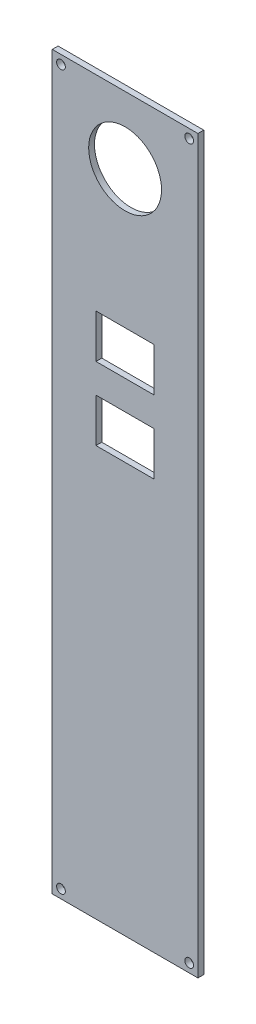
from build123d import *

# Parameters (mm, degrees)
SKETCH1_W           = 50
SKETCH1_H           = 251
BOSS_EXTRUDE1_DEPTH = 2
CUT_EXTRUDE1_REACH  = 130.472
SKETCH2_R           = 12.5
SKETCH6_R           = 1.5
CUT_EXTRUDE5_DEPTH  = 2
SKETCH8_W           = 20
SKETCH8_H           = 15
CUT_EXTRUDE6_DEPTH  = 2


with BuildPart() as part:
    # Sketch1 → Boss-Extrude1 (new body)
    with BuildSketch(Plane(origin=(0, 15.253788563, 0), x_dir=(1, 0, 0), z_dir=(0, 0, 1))):
        with Locations((0, -0.5)):
            Rectangle(SKETCH1_W, SKETCH1_H)
    extrude(amount=BOSS_EXTRUDE1_DEPTH)

    # Sketch2 → Cut-Extrude1 (cut, up to next)
    with BuildSketch(Plane(origin=(0, 15.253788563, 0), x_dir=(-1, 0, 0), z_dir=(0, 0, -1)), mode=Mode.PRIVATE) as cut_extrude1_sk1:
        with Locations((0, 102)):
            Circle(SKETCH2_R)
    cut_extrude1_tool1 = extrude(cut_extrude1_sk1.sketch, amount=-CUT_EXTRUDE1_REACH, mode=Mode.PRIVATE) & part.part
    add(cut_extrude1_tool1.solids().sort_by_distance((0, 117.253789, 0))[0], mode=Mode.SUBTRACT)

    # Sketch6 → Cut-Extrude5 (cut)
    with BuildSketch(Plane(origin=(0, 15.253788563, 2), x_dir=(1, 0, 0), z_dir=(0, 0, 1))):
        with Locations((-22, 122)):
            Circle(SKETCH6_R)
        with Locations((22, 122)):
            Circle(SKETCH6_R)
        with Locations((-22, -123)):
            Circle(SKETCH6_R)
        with Locations((22, -123)):
            Circle(SKETCH6_R)
    extrude(amount=-CUT_EXTRUDE5_DEPTH, mode=Mode.SUBTRACT)

    # Sketch8 → Cut-Extrude6 (cut)
    with BuildSketch(Plane(origin=(0, 0, 0), x_dir=(-1, 0, 0), z_dir=(0, 0, -1))):
        with Locations((0, 62.5)):
            Rectangle(SKETCH8_W, SKETCH8_H)
        with Locations((0, 37.5)):
            Rectangle(SKETCH8_W, SKETCH8_H)
    extrude(amount=-CUT_EXTRUDE6_DEPTH, mode=Mode.SUBTRACT)


solid = part.part
